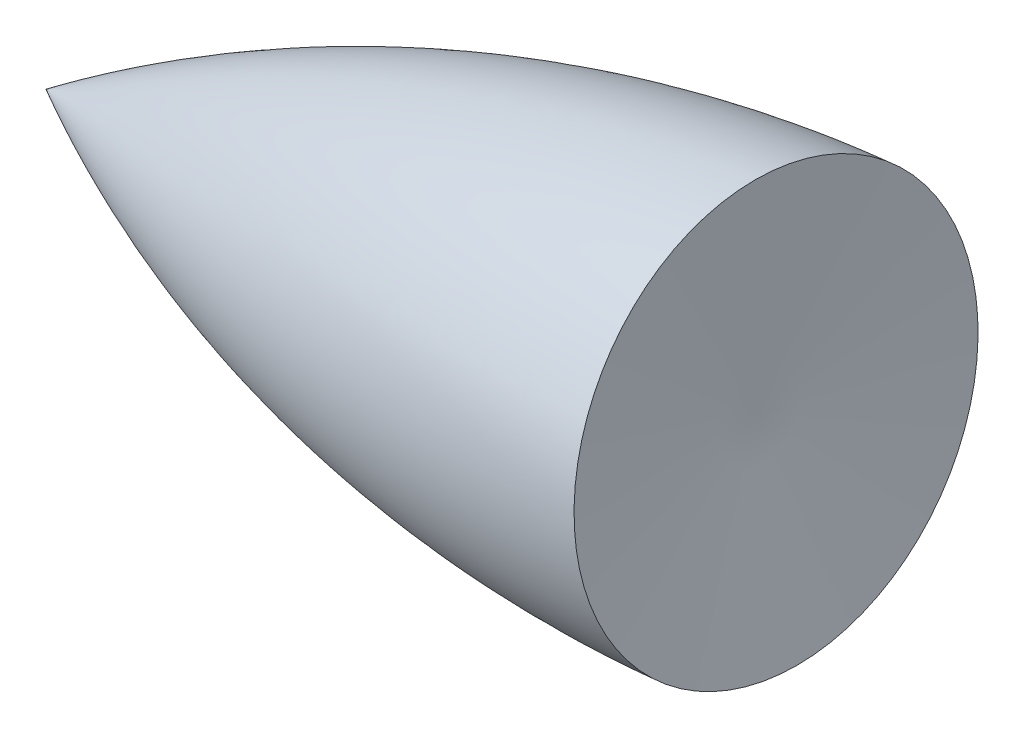
from build123d import *


with BuildPart() as part:
    # Sketch1 → Revolve2 (revolve)
    with BuildSketch(Plane.XY):
        with BuildLine():
            Line((18.140925866, 25.842262319), (89.335502851, 33.285255302))
            Line((89.335502851, 33.285255302), (89.335502851, 53.567073549))
            ThreePointArc((89.335502851, 53.567073549), (51.895932694, 44.435465294), (18.140925866, 25.842262319))
        make_face()
    revolve(axis=Axis((18.140925866, 25.842262319, 0), (0.9945796275322655, 0.10397771154329243, 0)))


solid = part.part
